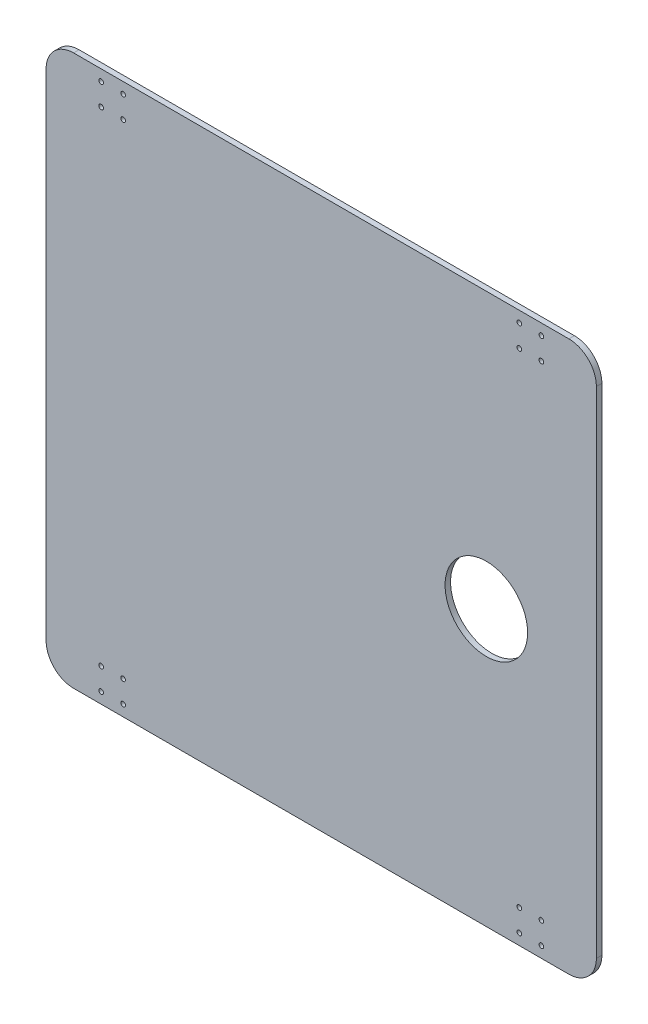
from build123d import *

# Parameters (mm, degrees)
SKETCH_1_W      = 1000
SKETCH_1_H      = 1000
SKETCH_1_R      = 75
SKETCH_1_R_2    = 4.25
EXTRUDE_1_DEPTH = 10
FILLET_1_R      = 50


with BuildPart() as part:
    # 草图1 → 凸台-拉伸1 (new body)
    with BuildSketch(Plane.XY):
        with Locations((500, -500)):
            Rectangle(SKETCH_1_W, SKETCH_1_H)
        with Locations((800, -500)):
            Circle(SKETCH_1_R, mode=Mode.SUBTRACT)
        with Locations((900, -20)):
            Circle(SKETCH_1_R_2, mode=Mode.SUBTRACT)
        with Locations((900, -60)):
            Circle(SKETCH_1_R_2, mode=Mode.SUBTRACT)
        with Locations((860, -20)):
            Circle(SKETCH_1_R_2, mode=Mode.SUBTRACT)
        with Locations((860, -60)):
            Circle(SKETCH_1_R_2, mode=Mode.SUBTRACT)
        with Locations(Location((140, -20, 0), (0, 0, 180))):
            Circle(SKETCH_1_R_2, mode=Mode.SUBTRACT)
        with Locations(Location((100, -20, 0), (0, 0, 180))):
            Circle(SKETCH_1_R_2, mode=Mode.SUBTRACT)
        with Locations(Location((140, -60, 0), (0, 0, 180))):
            Circle(SKETCH_1_R_2, mode=Mode.SUBTRACT)
        with Locations(Location((100, -60, 0), (0, 0, 180))):
            Circle(SKETCH_1_R_2, mode=Mode.SUBTRACT)
        with Locations((100, -980)):
            Circle(SKETCH_1_R_2, mode=Mode.SUBTRACT)
        with Locations((140, -980)):
            Circle(SKETCH_1_R_2, mode=Mode.SUBTRACT)
        with Locations((100, -940)):
            Circle(SKETCH_1_R_2, mode=Mode.SUBTRACT)
        with Locations((140, -940)):
            Circle(SKETCH_1_R_2, mode=Mode.SUBTRACT)
        with Locations(Location((860, -980, 0), (0, 0, 180))):
            Circle(SKETCH_1_R_2, mode=Mode.SUBTRACT)
        with Locations(Location((900, -980, 0), (0, 0, 180))):
            Circle(SKETCH_1_R_2, mode=Mode.SUBTRACT)
        with Locations(Location((860, -940, 0), (0, 0, 180))):
            Circle(SKETCH_1_R_2, mode=Mode.SUBTRACT)
        with Locations(Location((900, -940, 0), (0, 0, 180))):
            Circle(SKETCH_1_R_2, mode=Mode.SUBTRACT)
    extrude(amount=EXTRUDE_1_DEPTH)

    # 圆角1
    fillet_1_edges = [part.edges().sort_by_distance(p)[0] for p in [
        (0, 0, 5),
        (1000, 0, 5),
        (1000, -1000, 5),
        (0, -1000, 5),
    ]]
    fillet(fillet_1_edges, radius=FILLET_1_R)


solid = part.part
